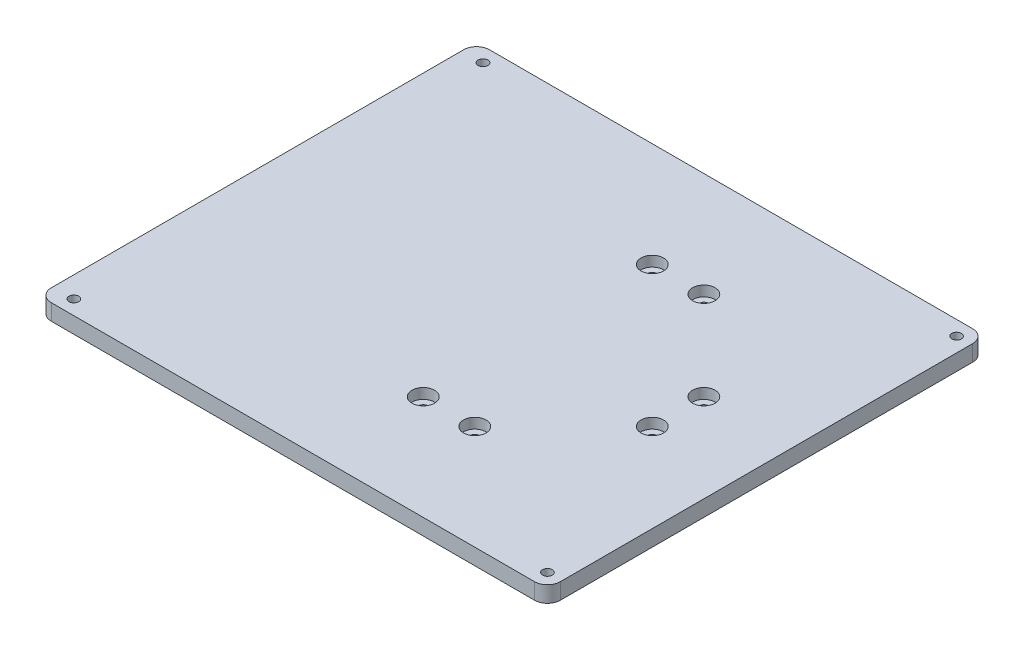
from build123d import *

# Parameters (mm, degrees)
SKETCH8_W           = 158
SKETCH8_H           = 136
SKETCH8_R           = 1.5
BOSS_EXTRUDE4_DEPTH = 5
FILLET2_R           = 4
SKETCH10_R          = 1.5
CUT_EXTRUDE5_DEPTH  = 5
SKETCH11_R          = 3.5
CUT_EXTRUDE6_DEPTH  = 3.2


with BuildPart() as part:
    # Sketch8 → Boss-Extrude4 (new body)
    with BuildSketch(Plane(origin=(0, 0, 0), x_dir=(1, 0, 0), z_dir=(0, 1, 0))):
        Rectangle(SKETCH8_W, SKETCH8_H)
        with Locations(Location((74.5, 63.5, 0), (0, 0, 270))):
            Circle(SKETCH8_R, mode=Mode.SUBTRACT)
        with Locations(Location((-72.5, 63.5, 0), (0, 0, 270))):
            Circle(SKETCH8_R, mode=Mode.SUBTRACT)
        with Locations(Location((-72.5, -63.5, 0), (0, 0, 90))):
            Circle(SKETCH8_R, mode=Mode.SUBTRACT)
        with Locations(Location((74.5, -63.5, 0), (0, 0, 90))):
            Circle(SKETCH8_R, mode=Mode.SUBTRACT)
    extrude(amount=BOSS_EXTRUDE4_DEPTH)

    # Fillet2
    fillet2_edges = [part.edges().sort_by_distance(p)[0] for p in [
        (79, 2.5, 68),
        (-79, 2.5, 68),
        (-79, 2.5, -68),
        (79, 2.5, -68),
    ]]
    fillet(fillet2_edges, radius=FILLET2_R)

    # Sketch10 → Cut-Extrude5 (cut)
    with BuildSketch(Plane(origin=(0, 5, 0), x_dir=(1, 0, 0), z_dir=(0, 1, 0))):
        with Locations(Location((24, 35.55, 0), (0, 0, 270))):
            Circle(SKETCH10_R)
        with Locations(Location((24, -35.55, 0), (0, 0, 90))):
            Circle(SKETCH10_R)
        with Locations(Location((8, -35.55, 0), (0, 0, 270))):
            Circle(SKETCH10_R)
        with Locations(Location((8, 35.55, 0), (0, 0, 90))):
            Circle(SKETCH10_R)
        with Locations(Location((51.55, -8, 0), (0, 0, 270))):
            Circle(SKETCH10_R)
        with Locations(Location((51.55, 8, 0), (0, 0, 90))):
            Circle(SKETCH10_R)
    extrude(amount=-CUT_EXTRUDE5_DEPTH, mode=Mode.SUBTRACT)

    # Sketch11 → Cut-Extrude6 (cut)
    with BuildSketch(Plane(origin=(0, 5, 0), x_dir=(1, 0, 0), z_dir=(0, 1, 0))):
        with Locations(Location((24, 35.55, 0), (0, 0, 270))):
            Circle(SKETCH11_R)
        with Locations(Location((8, 35.55, 0), (0, 0, 270))):
            Circle(SKETCH11_R)
        with Locations(Location((51.55, 8, 0), (0, 0, 270))):
            Circle(SKETCH11_R)
        with Locations(Location((51.55, -8, 0), (0, 0, 270))):
            Circle(SKETCH11_R)
        with Locations(Location((24, -35.55, 0), (0, 0, 270))):
            Circle(SKETCH11_R)
        with Locations(Location((8, -35.55, 0), (0, 0, 270))):
            Circle(SKETCH11_R)
    extrude(amount=-CUT_EXTRUDE6_DEPTH, mode=Mode.SUBTRACT)


solid = part.part
